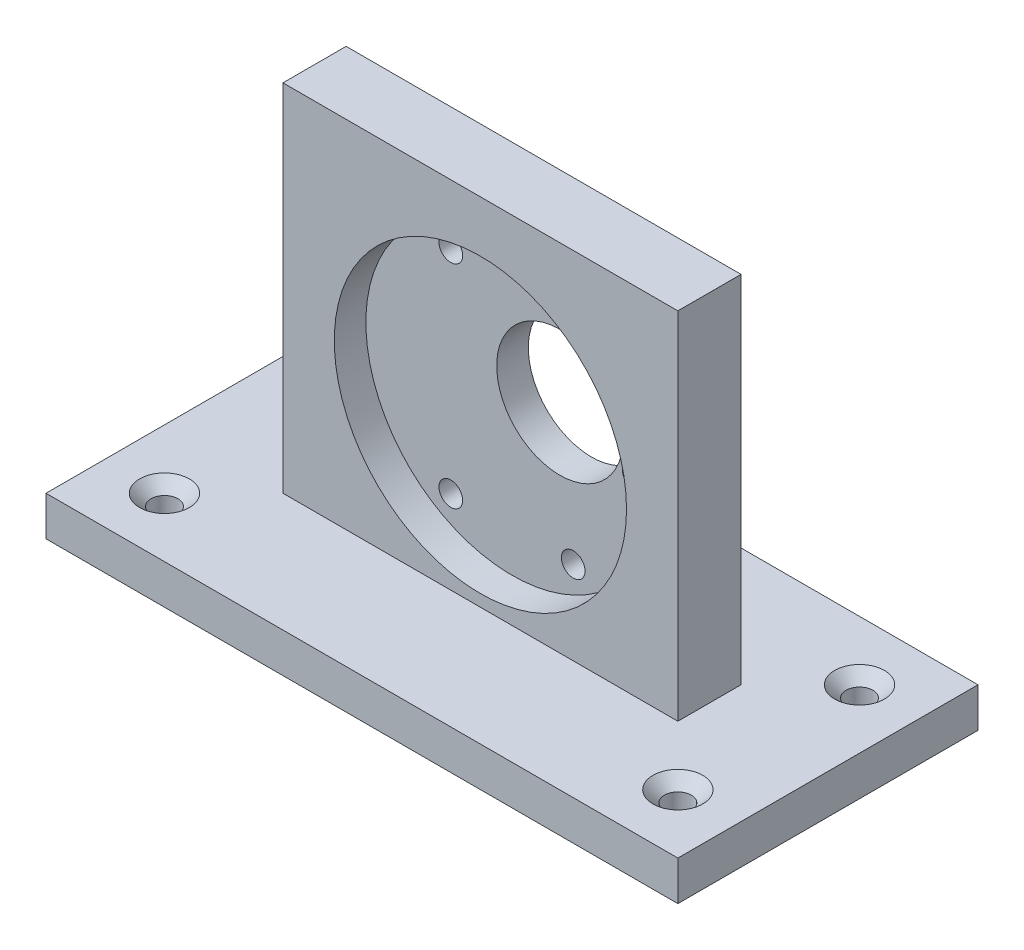
from build123d import *

# Parameters (mm, degrees)
SKETCH3_W                                       = 50
SKETCH3_H                                       = 50
BOSS_EXTRUDE1_DEPTH                             = 8
SKETCH3_3_R                                     = 1.5
SKETCH3_3_R_2                                   = 8
CUT_EXTRUDE2_DEPTH                              = 10
SKETCH4_R                                       = 18.5
CUT_EXTRUDE3_DEPTH                              = 4
BOSS_EXTRUDE2_DEPTH                             = 15
BOSS_EXTRUDE2_DEPTH_BACK                        = 23
SKETCH6_W                                       = 80
SKETCH6_H                                       = 5
CSK_FOR_M3_FLAT_HEAD_MACHINE_SCREW1_D           = 3.4
CSK_FOR_M3_FLAT_HEAD_MACHINE_SCREW1_CSINK_D     = 6.3
CSK_FOR_M3_FLAT_HEAD_MACHINE_SCREW1_CSINK_ANGLE = 90
SKETCH11_R                                      = 6.207
SKETCH11_R_2                                    = 5.207
BOSS_EXTRUDE3_DEPTH                             = 5


with BuildPart() as part:
    # Sketch3 → Boss-Extrude1 (new body)
    with BuildSketch(Plane.XY):
        with Locations((0, 25)):
            Rectangle(SKETCH3_W, SKETCH3_H)
    extrude(amount=BOSS_EXTRUDE1_DEPTH)

    # Sketch3<3> → Cut-Extrude2 (cut)
    with BuildSketch(Plane.XY):
        with Locations((-7.75, 38.423393759)):
            Circle(SKETCH3_3_R)
        with Locations((7.75, 38.423393759)):
            Circle(SKETCH3_3_R)
        with Locations((-7.75, 11.576606241)):
            Circle(SKETCH3_3_R)
        with Locations((7.75, 11.576606241)):
            Circle(SKETCH3_3_R)
        with Locations((15.5, 25)):
            Circle(SKETCH3_3_R)
        with Locations((6.062177825, 28.499999999)):
            Circle(SKETCH3_3_R_2)
    extrude(amount=CUT_EXTRUDE2_DEPTH, mode=Mode.SUBTRACT)

    # Sketch4 → Cut-Extrude3 (cut)
    with BuildSketch(Plane.XY.offset(8)):
        with Locations((0, 25)):
            Circle(SKETCH4_R)
    extrude(amount=-CUT_EXTRUDE3_DEPTH, mode=Mode.SUBTRACT)

    # Sketch6 → Boss-Extrude2 (add, two sides: drawn at the far end of the back side and taken through both)
    with BuildSketch(Plane.XY.offset(8).offset(-BOSS_EXTRUDE2_DEPTH_BACK)):
        with Locations((0, 2.5)):
            Rectangle(SKETCH6_W, SKETCH6_H)
    extrude(amount=BOSS_EXTRUDE2_DEPTH + BOSS_EXTRUDE2_DEPTH_BACK)

    # CSK for M3 Flat Head Machine Screw1 (through all)
    with Locations(Plane(origin=(0, 5, 0), x_dir=(1, 0, 0), z_dir=(0, 1, 0))):
        with Locations((-32.5, 7.5), (-32.5, -15.5), (32.5, -15.5), (32.5, 7.5)):
            CounterSinkHole(CSK_FOR_M3_FLAT_HEAD_MACHINE_SCREW1_D / 2, CSK_FOR_M3_FLAT_HEAD_MACHINE_SCREW1_CSINK_D / 2, counter_sink_angle=CSK_FOR_M3_FLAT_HEAD_MACHINE_SCREW1_CSINK_ANGLE)

    # Sketch11 → Boss-Extrude3 (add)
    with BuildSketch(Plane(origin=(0, 0, 0), x_dir=(-1, 0, 0), z_dir=(0, 0, -1))):
        with Locations((17.917822175, 28.499999999)):
            Circle(SKETCH11_R)
        with Locations((17.917822175, 28.499999999)):
            Circle(SKETCH11_R_2, mode=Mode.SUBTRACT)
    extrude(amount=BOSS_EXTRUDE3_DEPTH)


solid = part.part
